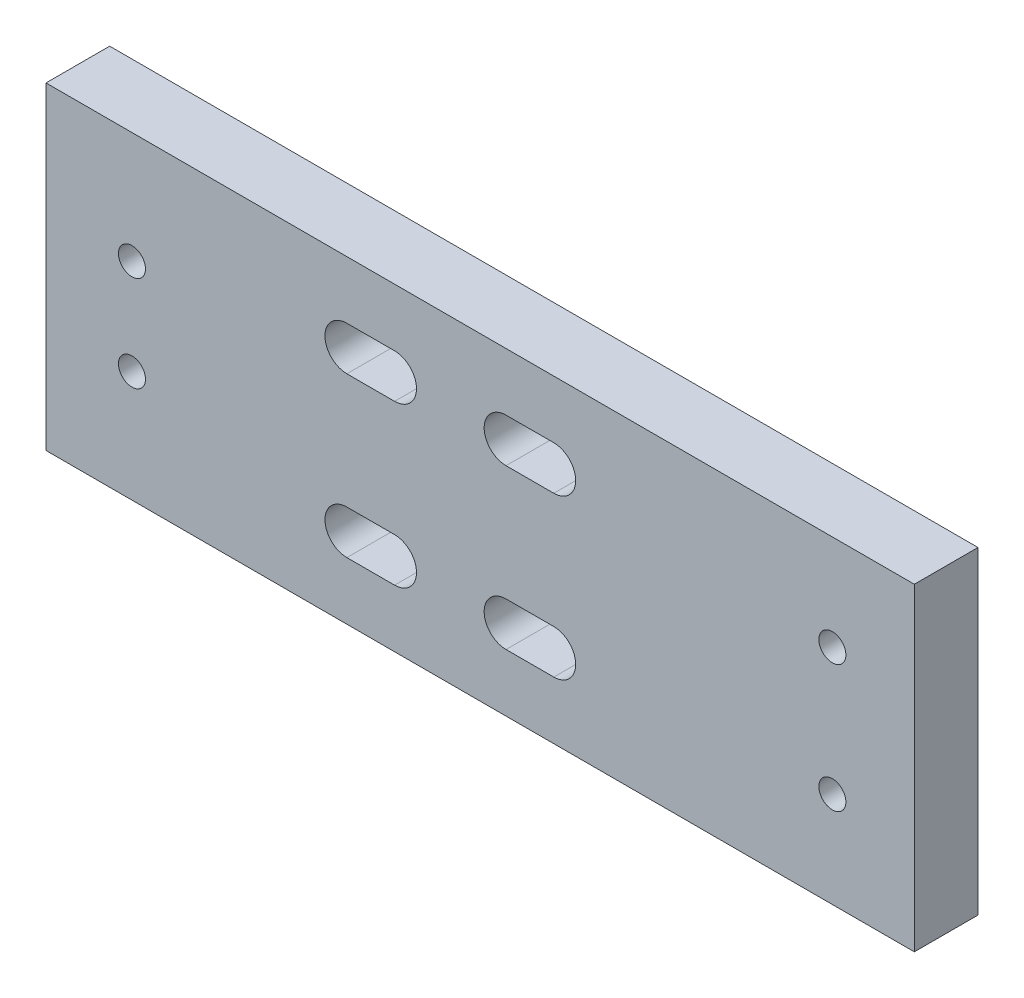
from build123d import *

# Parameters (mm, degrees)
SKETCH1_W           = 109.1
SKETCH1_H           = 40
SKETCH1_R           = 1.7
BOSS_EXTRUDE1_DEPTH = 8
SKETCH2_R           = 3.3
CUT_EXTRUDE1_DEPTH  = 3.5


with BuildPart() as part:
    # Sketch1 → Boss-Extrude1 (new body)
    with BuildSketch(Plane.XY.offset(238)):
        with Locations((281.75, 300)):
            Rectangle(SKETCH1_W, SKETCH1_H)
        with Locations((238, 294)):
            Circle(SKETCH1_R, mode=Mode.SUBTRACT)
        with Locations((238, 306)):
            Circle(SKETCH1_R, mode=Mode.SUBTRACT)
        with Locations((326, 292)):
            Circle(SKETCH1_R, mode=Mode.SUBTRACT)
        with Locations((326, 308)):
            Circle(SKETCH1_R, mode=Mode.SUBTRACT)
        with BuildLine():
            Line((265, 287.25), (271, 287.25))
            ThreePointArc((271, 287.25), (273.75, 290), (271, 292.75))
            Line((271, 292.75), (265, 292.75))
            ThreePointArc((265, 292.75), (262.25, 290), (265, 287.25))
        make_face(mode=Mode.SUBTRACT)
        with BuildLine():
            Line((265, 307.25), (271, 307.25))
            ThreePointArc((271, 307.25), (273.75, 310), (271, 312.75))
            Line((271, 312.75), (265, 312.75))
            ThreePointArc((265, 312.75), (262.25, 310), (265, 307.25))
        make_face(mode=Mode.SUBTRACT)
        with BuildLine():
            Line((285, 287.25), (291, 287.25))
            ThreePointArc((291, 287.25), (293.75, 290), (291, 292.75))
            Line((291, 292.75), (285, 292.75))
            ThreePointArc((285, 292.75), (282.25, 290), (285, 287.25))
        make_face(mode=Mode.SUBTRACT)
        with BuildLine():
            Line((285, 307.25), (291, 307.25))
            ThreePointArc((291, 307.25), (293.75, 310), (291, 312.75))
            Line((291, 312.75), (285, 312.75))
            ThreePointArc((285, 312.75), (282.25, 310), (285, 307.25))
        make_face(mode=Mode.SUBTRACT)
    extrude(amount=BOSS_EXTRUDE1_DEPTH)

    # Sketch2 → Cut-Extrude1 (cut)
    with BuildSketch(Plane.XY.offset(238)):
        with Locations((238, 294)):
            Circle(SKETCH2_R)
        with Locations((238, 306)):
            Circle(SKETCH2_R)
        with Locations((326, 292)):
            Circle(SKETCH2_R)
        with Locations((326, 308)):
            Circle(SKETCH2_R)
    extrude(amount=CUT_EXTRUDE1_DEPTH, mode=Mode.SUBTRACT)


solid = part.part
